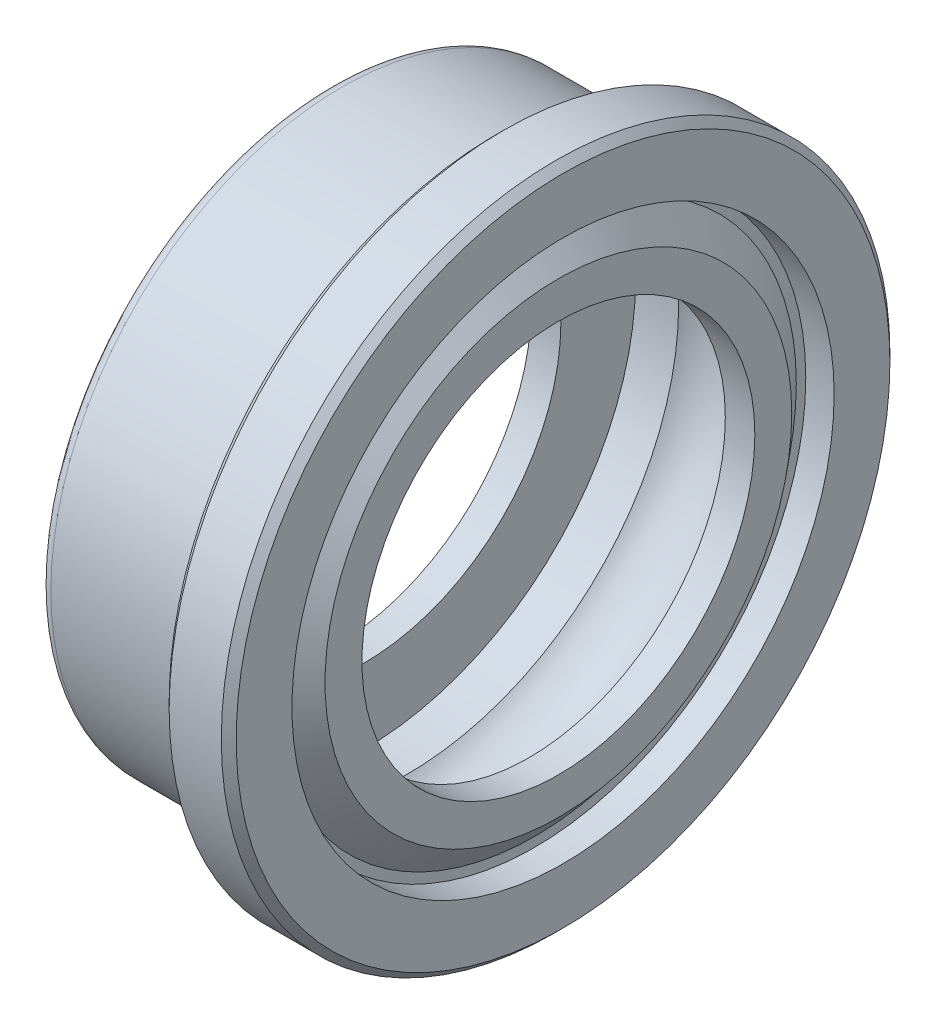
from build123d import *


with BuildPart() as part:
    # Sketch1 → Revolve1 (revolve)
    with BuildSketch(Plane.XY, mode=Mode.PRIVATE) as revolve1_sk:
        with BuildLine():
            Line((0.532839829, 3.6972875), (1.121293646, 3.6972875))
            Line((1.121293646, 3.6972875), (1.121293646, 2.679239625))
            Line((1.121293646, 2.679239625), (1.524, 2.679239625))
            Line((1.524, 2.679239625), (1.524, 3.182551134))
            Line((1.524, 3.182551134), (1.200668646, 3.567882437))
            Line((1.200668646, 3.567882437), (1.200668646, 3.6972875))
            Line((1.200668646, 3.6972875), (1.5875, 3.6972875))
            Line((1.5875, 3.6972875), (1.5875, 4.4577))
            Line((1.5875, 4.4577), (1.4859, 4.5593))
            Line((1.4859, 4.5593), (0.7747, 4.5593))
            Line((0.7747, 4.5593), (0.6731, 4.4577))
            Line((0.6731, 4.4577), (0.6731, 4.12115))
            ThreePointArc((0.6731, 4.12115), (0.628463073, 4.013386927), (0.5207, 3.96875))
            Line((0.5207, 3.96875), (-1.42875, 3.96875))
            ThreePointArc((-1.42875, 3.96875), (-1.541003202, 3.922253202), (-1.5875, 3.81))
            Line((-1.5875, 3.81), (-1.5875, 3.6972875))
            Line((-1.5875, 3.6972875), (-1.200668646, 3.6972875))
            Line((-1.200668646, 3.6972875), (-1.200668646, 3.567882438))
            Line((-1.200668646, 3.567882438), (-1.524, 3.182551134))
            Line((-1.524, 3.182551134), (-1.524, 2.679239625))
            Line((-1.524, 2.679239625), (-1.121293646, 2.679239625))
            Line((-1.121293646, 2.679239625), (-1.121293646, 3.6972875))
            Line((-1.121293646, 3.6972875), (-0.532839829, 3.6972875))
            ThreePointArc((-0.532839829, 3.6972875), (0, 3.921125), (0.532839829, 3.6972875))
        make_face()
    revolve(revolve1_sk.sketch.rotate(Axis((-1.5875, 0, 0), (1, 0, 0)), 270), axis=Axis((-1.5875, 0, 0), (1, 0, 0)))


solid = part.part
